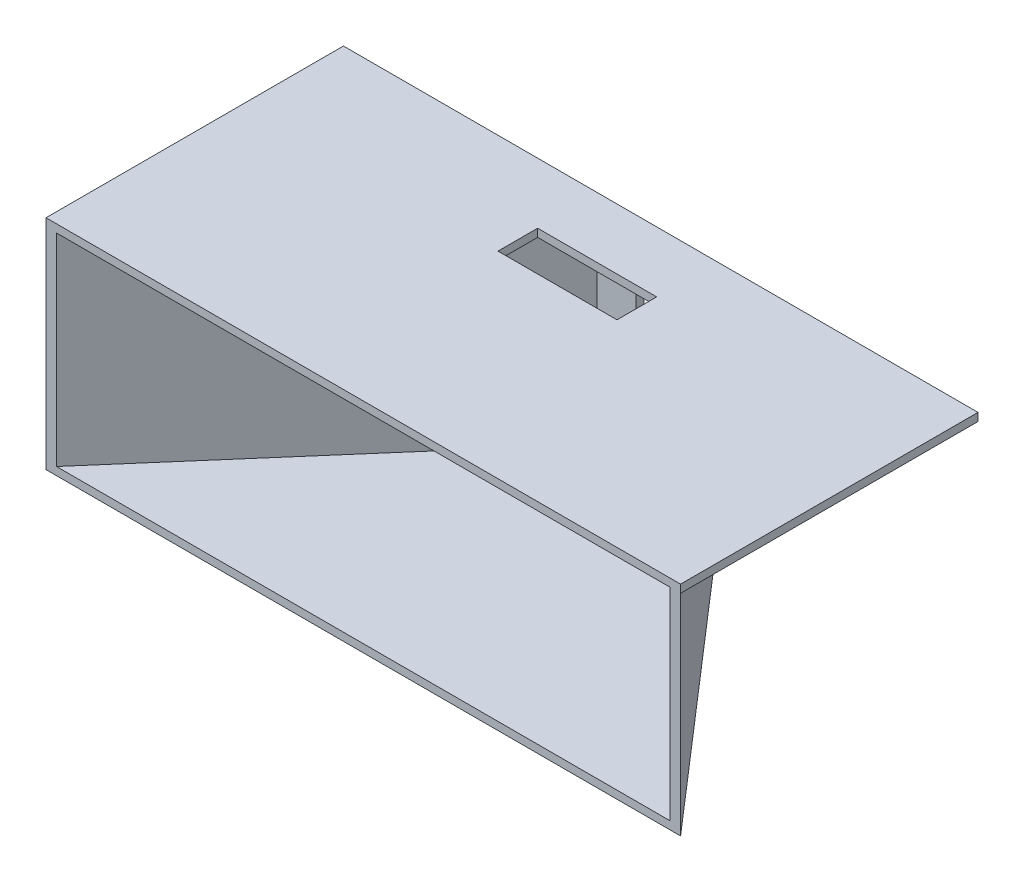
from build123d import *

# Parameters (mm, degrees)
BOSS_EXTRUDE1_DEPTH = 55
SHELL1_T            = -2
SKETCH6_W           = 30
SKETCH6_H           = 10.709947061
CUT_EXTRUDE3_DEPTH  = 4
SKETCH5_W           = 8.5
SKETCH5_H           = 8.497801987
CUT_EXTRUDE5_DEPTH  = 6
SKETCH10_W          = 160
SKETCH10_H          = 2
BOSS_EXTRUDE2_DEPTH = 75
SKETCH11_W          = 30
SKETCH11_H          = 10
CUT_EXTRUDE6_DEPTH  = 8


with BuildPart() as part:
    # Sketch1 → Boss-Extrude1 (new body)
    with BuildSketch(Plane(origin=(0, 0, 0), x_dir=(1, 0, 0), z_dir=(0, 1, 0))):
        Polygon((0, 0), (-160, 0), (-94.996692416, 75), (-64.996692416, 75), align=None)
    extrude(amount=-BOSS_EXTRUDE1_DEPTH)

    # Shell1
    shell1_openings = [part.faces().sort_by_distance(p)[0] for p in [
        (-80, -27.5, 0),
    ]]
    offset(amount=SHELL1_T, openings=shell1_openings, kind=Kind.INTERSECTION)

    # Sketch6 → Cut-Extrude3 (cut)
    with BuildSketch(Plane(origin=(0, 0, 0), x_dir=(1, 0, 0), z_dir=(0, 1, 0))):
        with Locations((-80.447039031, 51.579276021)):
            Rectangle(SKETCH6_W, SKETCH6_H)
    extrude(amount=-CUT_EXTRUDE3_DEPTH, mode=Mode.SUBTRACT)

    # Sketch5 → Cut-Extrude5 (cut)
    with BuildSketch(Plane.XY.offset(-73)):
        with Locations((-79.998465085, -16.748900994)):
            Rectangle(SKETCH5_W, SKETCH5_H)
    extrude(amount=-CUT_EXTRUDE5_DEPTH, mode=Mode.SUBTRACT)

    # Sketch10 → Boss-Extrude2 (add)
    with BuildSketch(Plane.XY):
        with Locations((-80, -1)):
            Rectangle(SKETCH10_W, SKETCH10_H)
    extrude(amount=-BOSS_EXTRUDE2_DEPTH)

    # Sketch11 → Cut-Extrude6 (cut)
    with BuildSketch(Plane(origin=(0, -2, 0), x_dir=(-1, 0, 0), z_dir=(0, -1, 0))):
        with Locations((80.729529252, 54.69995574)):
            Rectangle(SKETCH11_W, SKETCH11_H)
    extrude(amount=-CUT_EXTRUDE6_DEPTH, mode=Mode.SUBTRACT)


solid = part.part
